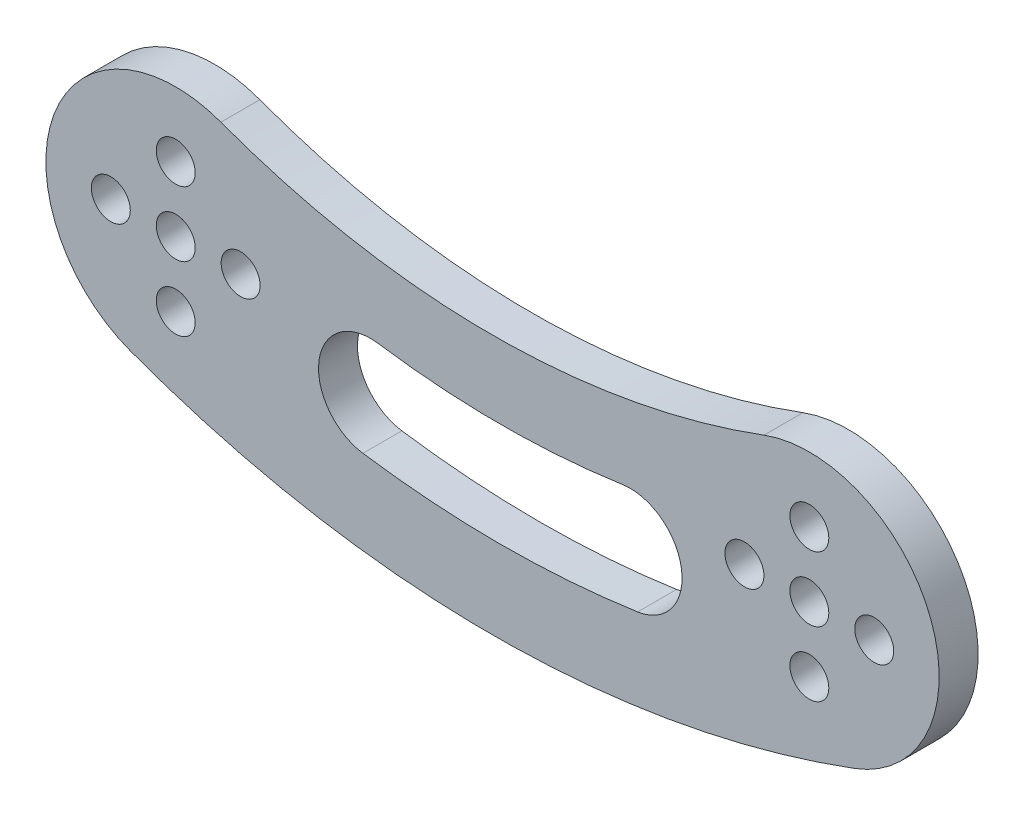
from build123d import *

# Parameters (mm, degrees)
IZIM3_R                     = 1.5
Y_KSEKLIK_EKSTR_ZYON1_DEPTH = 3


with BuildPart() as part:
    # Çizim3 → Yükseklik-Ekstrüzyon1 (new body)
    with BuildSketch(Plane.XY):
        with BuildLine():
            ThreePointArc((-21.522830549, 9.375995553), (-34.375995553, 3.477169451), (-28.477169451, -9.375995553))
            ThreePointArc((-28.477169451, -9.375995553), (-0.585261649, -14.367996391), (27.297293596, -9.324019171))
            ThreePointArc((27.297293596, -9.324019171), (33.172153672, 3.540117765), (20.308016736, 9.41497784))
            ThreePointArc((20.308016736, 9.41497784), (-0.603899698, 5.631994925), (-21.522830549, 9.375995553))
        make_face()
        with Locations((-25, 0)):
            Circle(IZIM3_R, mode=Mode.SUBTRACT)
        with Locations((-25, 5)):
            Circle(IZIM3_R, mode=Mode.SUBTRACT)
        with Locations((-30, 0)):
            Circle(IZIM3_R, mode=Mode.SUBTRACT)
        with Locations((-20, 0)):
            Circle(IZIM3_R, mode=Mode.SUBTRACT)
        with Locations((-25, -5)):
            Circle(IZIM3_R, mode=Mode.SUBTRACT)
        with Locations((23.802655166, 0.045479334)):
            Circle(IZIM3_R, mode=Mode.SUBTRACT)
        with Locations((23.802655166, 5.045479334)):
            Circle(IZIM3_R, mode=Mode.SUBTRACT)
        with Locations((28.802448325, 0)):
            Circle(IZIM3_R, mode=Mode.SUBTRACT)
        with Locations((18.802655166, 0.045479334)):
            Circle(IZIM3_R, mode=Mode.SUBTRACT)
        with Locations((23.802655166, -4.954520666)):
            Circle(IZIM3_R, mode=Mode.SUBTRACT)
        with BuildLine():
            ThreePointArc((-9.420289855, 0.673684705), (0, -0.012567627), (9.420289855, 0.673684705))
            ThreePointArc((9.420289855, 0.673684705), (13.957769087, -2.704374237), (10.579710145, -7.241853469))
            ThreePointArc((10.579710145, -7.241853469), (0, -8.012567627), (-10.579710145, -7.241853469))
            ThreePointArc((-10.579710145, -7.241853469), (-13.957769087, -2.704374237), (-9.420289855, 0.673684705))
        make_face(mode=Mode.SUBTRACT)
    extrude(amount=Y_KSEKLIK_EKSTR_ZYON1_DEPTH)


solid = part.part
